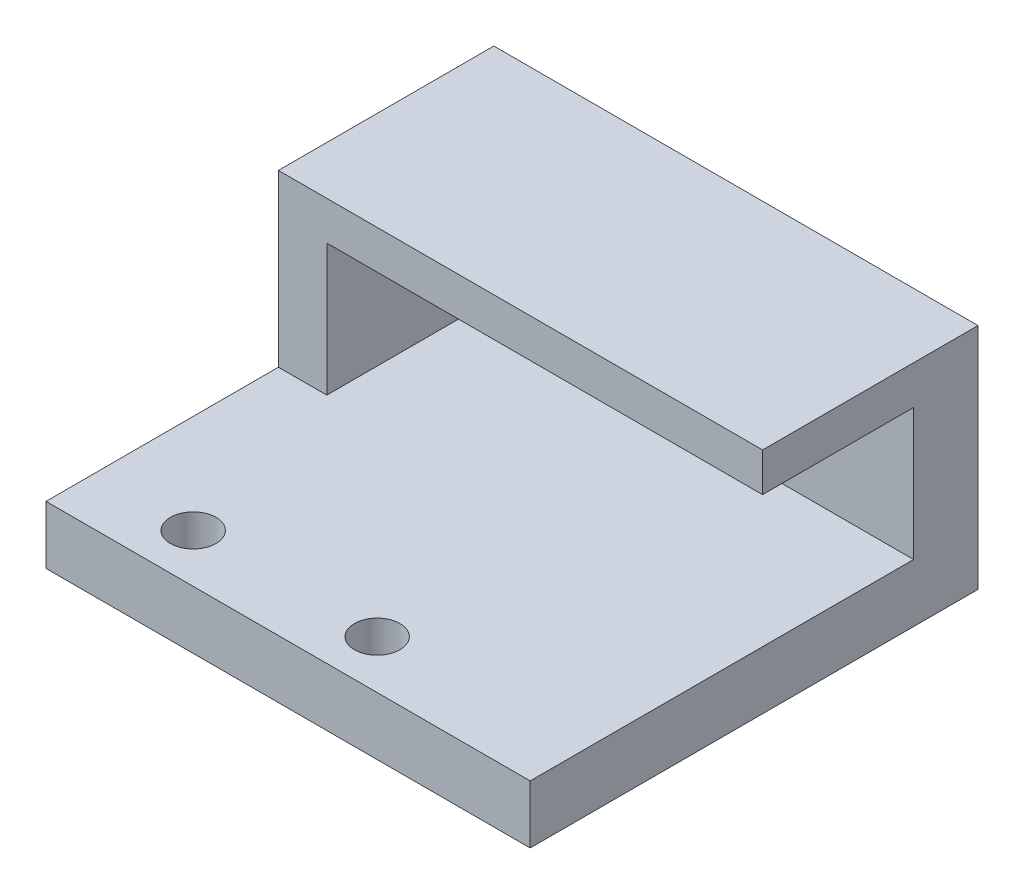
from build123d import *

# Parameters (mm, degrees)
SKETCH1_W           = 25
SKETCH1_H           = 20
SKETCH1_R           = 1.175
BOSS_EXTRUDE2_DEPTH = 3
SKETCH3_W           = 2.5
SKETCH3_H           = 8
BOSS_EXTRUDE3_DEPTH = 6.8
SKETCH5_W           = 2.5
SKETCH5_H           = 6.8
BOSS_EXTRUDE5_DEPTH = 6.8
SKETCH7_R           = 1.8
CUT_EXTRUDE1_DEPTH  = 6.8
SKETCH8_W           = 7
SKETCH8_H           = 6.8
BOSS_EXTRUDE6_DEPTH = 22.5
SKETCH9_W           = 25
SKETCH9_H           = 14.8
BOSS_EXTRUDE7_DEPTH = 2
SKETCH10_W          = 3.676013555
SKETCH10_H          = 11.8
CUT_EXTRUDE2_DEPTH  = 36


with BuildPart() as part:
    # Sketch1 → Boss-Extrude2 (new body)
    with BuildSketch(Plane(origin=(0, 0, 0), x_dir=(1, 0, 0), z_dir=(0, 1, 0))):
        with Locations((12.5, 10)):
            Rectangle(SKETCH1_W, SKETCH1_H)
        with Locations(Location((5.1, 2.5, 0), (0, 0, 270))):
            Circle(SKETCH1_R, mode=Mode.SUBTRACT)
        with Locations(Location((14.6, 2.5, 0), (0, 0, 270))):
            Circle(SKETCH1_R, mode=Mode.SUBTRACT)
    extrude(amount=BOSS_EXTRUDE2_DEPTH)

    # Sketch3 → Boss-Extrude3 (add)
    with BuildSketch(Plane(origin=(0, 3, 0), x_dir=(1, 0, 0), z_dir=(0, 1, 0))):
        with Locations((1.25, 16)):
            Rectangle(SKETCH3_W, SKETCH3_H)
    extrude(amount=BOSS_EXTRUDE3_DEPTH)

    # Sketch5 → Boss-Extrude5 (add)
    with BuildSketch(Plane(origin=(0, 0, -20), x_dir=(-1, 0, 0), z_dir=(0, 0, -1))):
        Polygon((0, 0), (0, 3), (-2.5, 3), (-25, 3), (-25, 0), align=None)
        with Locations((-1.25, 6.4)):
            Rectangle(SKETCH5_W, SKETCH5_H)
    extrude(amount=BOSS_EXTRUDE5_DEPTH)

    # Sketch7 → Cut-Extrude1 (cut)
    with BuildSketch(Plane.ZY):
        with Locations((-18, 6.4)):
            Circle(SKETCH7_R)
    extrude(amount=-CUT_EXTRUDE1_DEPTH, mode=Mode.SUBTRACT)

    # Sketch8 → Boss-Extrude6 (add)
    with BuildSketch(Plane(origin=(2.5, 0, 0), x_dir=(0, 0, -1), z_dir=(1, 0, 0))):
        with Locations((23.3, 6.4)):
            Rectangle(SKETCH8_W, SKETCH8_H)
    extrude(amount=BOSS_EXTRUDE6_DEPTH)

    # Sketch9 → Boss-Extrude7 (add)
    with BuildSketch(Plane(origin=(0, 9.8, 0), x_dir=(1, 0, 0), z_dir=(0, 1, 0))):
        with Locations((12.5, 19.4)):
            Rectangle(SKETCH9_W, SKETCH9_H)
    extrude(amount=BOSS_EXTRUDE7_DEPTH)

    # Sketch10 → Cut-Extrude2 (cut)
    with BuildSketch(Plane(origin=(25, 0, 0), x_dir=(0, 0, -1), z_dir=(1, 0, 0))):
        with Locations((24.961993222, 5.9)):
            Rectangle(SKETCH10_W, SKETCH10_H)
    extrude(amount=-CUT_EXTRUDE2_DEPTH, mode=Mode.SUBTRACT)


solid = part.part
